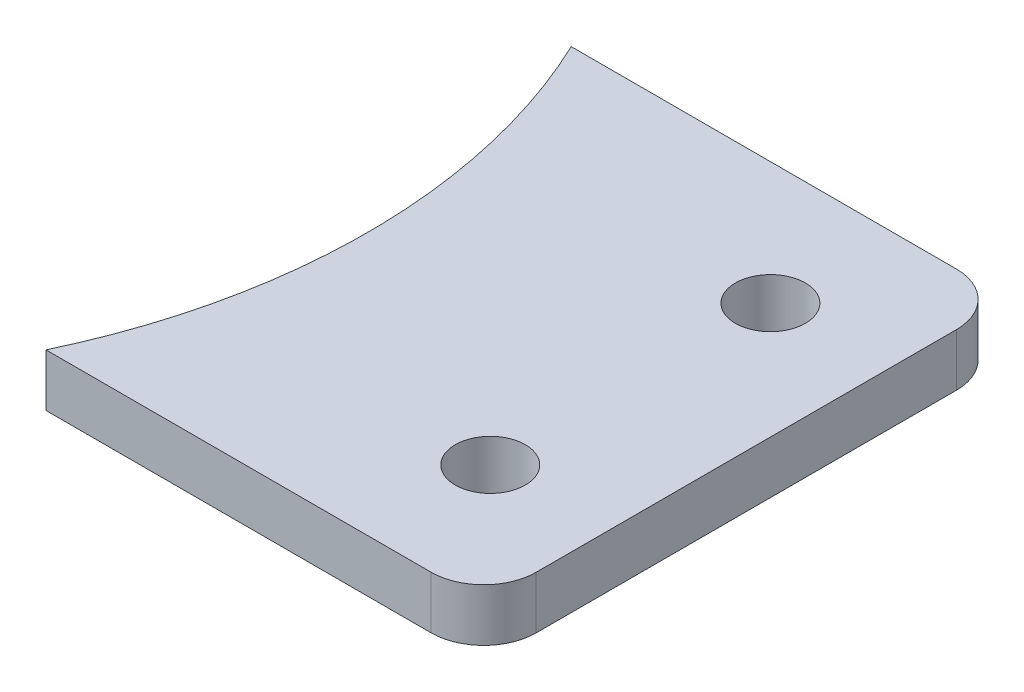
from build123d import *

# Parameters (mm, degrees)
SKETCH_1_R      = 2
EXTRUDE_1_DEPTH = 3
FILLET_1_R      = 3


with BuildPart() as part:
    # 草图1 → 凸台-拉伸1 (new body)
    with BuildSketch(Plane(origin=(0, 0, 0), x_dir=(1, 0, 0), z_dir=(0, 1, 0))):
        with BuildLine():
            Line((31.622776602, 15), (56.622776602, 15))
            Line((56.622776602, 15), (56.622776602, -15))
            Line((56.622776602, -15), (31.622776602, -15))
            ThreePointArc((31.622776602, -15), (35, 0), (31.622776602, 15))
        make_face()
        with Locations(Location((50, 8, 0), (0, 0, 270))):
            Circle(SKETCH_1_R, mode=Mode.SUBTRACT)
        with Locations(Location((50, -8, 0), (0, 0, 90))):
            Circle(SKETCH_1_R, mode=Mode.SUBTRACT)
    extrude(amount=EXTRUDE_1_DEPTH)

    # 圆角1
    fillet_1_edges = [part.edges().sort_by_distance(p)[0] for p in [
        (56.622776602, 1.5, -15),
        (56.622776602, 1.5, 15),
    ]]
    fillet(fillet_1_edges, radius=FILLET_1_R)


solid = part.part
